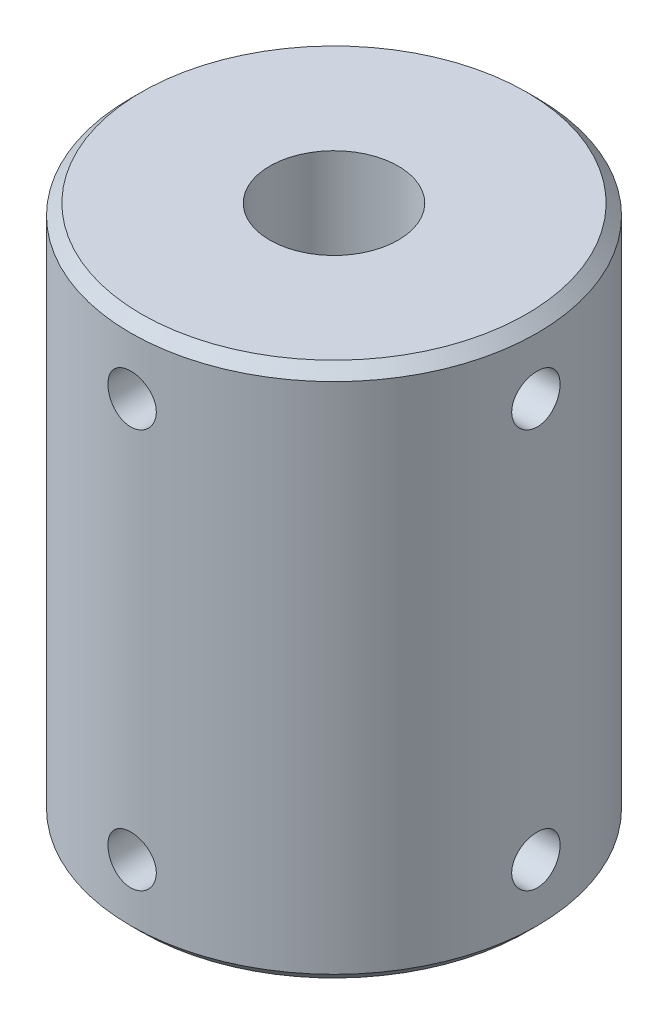
from build123d import *

# Parameters (mm, degrees)
SKETCH1_R                      = 9.5
BOSS_EXTRUDE1_DEPTH            = 25
CHAMFER1_SIZE                  = 0.508
F_6_0MM_DOWEL_HOLE1_D          = 6
SKETCH7_W                      = 1.1303
SKETCH7_H                      = 9.5
F_4_40_TAPPED_HOLE1_AT_2_COUNT = 2
F_4_40_TAPPED_HOLE1_AT_2_PITCH = 18.65
SKETCH10_W                     = 1.1303
SKETCH10_H                     = 9.5
F_4_40_TAPPED_HOLE2_AT_2_COUNT = 2
F_4_40_TAPPED_HOLE2_AT_2_PITCH = 18.65


with BuildPart() as part:
    # Sketch1 → Boss-Extrude1 (new body)
    with BuildSketch(Plane(origin=(0, 0, 0), x_dir=(1, 0, 0), z_dir=(0, 1, 0))):
        with Locations(Location((0, 0, 0), (0, 0, 270))):
            Circle(SKETCH1_R)
    extrude(amount=BOSS_EXTRUDE1_DEPTH)

    # Chamfer1
    chamfer1_edges = [part.edges().sort_by_distance(p)[0] for p in [
        (0, 0, -9.5),
        (0, 25, -9.5),
    ]]
    chamfer(chamfer1_edges, length=CHAMFER1_SIZE)

    # Ø6.0mm Dowel Hole1 (through all)
    with Locations(Plane(origin=(0, 25, 0), x_dir=(1, 0, 0), z_dir=(0, 1, 0))):
        with Locations((0, 0)):
            Hole(F_6_0MM_DOWEL_HOLE1_D / 2)

    # Sketch7 → #4-40 Tapped Hole1 (revolve, cut)
    with BuildSketch(Plane.ZX.offset(21.825)):
        with Locations((0.56515, 4.75)):
            Rectangle(SKETCH7_W, SKETCH7_H)
    f_4_40_tapped_hole1 = revolve(axis=Axis((-6.35, 21.825, 0), (1, 0, 0)), mode=Mode.SUBTRACT)

    # #4-40 Tapped Hole1 at 2: #4-40 Tapped Hole1 ×2
    with Locations(*[(0, -i * F_4_40_TAPPED_HOLE1_AT_2_PITCH, 0) for i in range(1, F_4_40_TAPPED_HOLE1_AT_2_COUNT)]):
        add(f_4_40_tapped_hole1, mode=Mode.SUBTRACT)

    # Sketch10 → #4-40 Tapped Hole2 (revolve, cut)
    with BuildSketch(Plane(origin=(0, 21.825, 0), x_dir=(0, 1, 0), z_dir=(1, 0, 0))):
        with Locations((0.56515, 4.75)):
            Rectangle(SKETCH10_W, SKETCH10_H)
    f_4_40_tapped_hole2 = revolve(axis=Axis((0, 21.825, -6.35), (0, 0, 1)), mode=Mode.SUBTRACT)

    # #4-40 Tapped Hole2 at 2: #4-40 Tapped Hole2 ×2
    with Locations(*[(0, -i * F_4_40_TAPPED_HOLE2_AT_2_PITCH, 0) for i in range(1, F_4_40_TAPPED_HOLE2_AT_2_COUNT)]):
        add(f_4_40_tapped_hole2, mode=Mode.SUBTRACT)


solid = part.part
